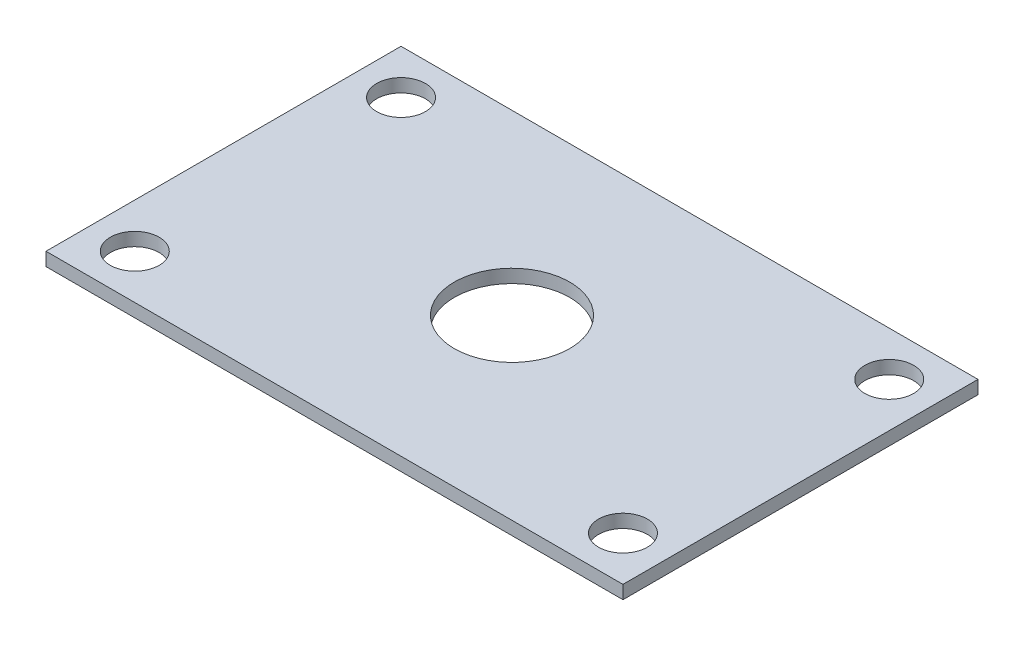
from build123d import *

# Parameters (mm, degrees)
CROQUIS1_W              = 130
CROQUIS1_H              = 80
SALIENTE_EXTRUIR1_DEPTH = 3
CROQUIS2_R              = 13
CORTAR_EXTRUIR1_DEPTH   = 3
CROQUIS3_R              = 5.5
CORTAR_EXTRUIR2_DEPTH   = 3


with BuildPart() as part:
    # Croquis1 → Saliente-Extruir1 (new body)
    with BuildSketch(Plane(origin=(0, 0, 0), x_dir=(1, 0, 0), z_dir=(0, 1, 0))):
        Rectangle(CROQUIS1_W, CROQUIS1_H)
    extrude(amount=SALIENTE_EXTRUIR1_DEPTH)

    # Croquis2 → Cortar-Extruir1 (cut)
    with BuildSketch(Plane(origin=(0, 3, 0), x_dir=(1, 0, 0), z_dir=(0, 1, 0))):
        with Locations(Location((0, 0, 0), (0, 0, 270))):
            Circle(CROQUIS2_R)
    extrude(amount=-CORTAR_EXTRUIR1_DEPTH, mode=Mode.SUBTRACT)

    # Croquis3 → Cortar-Extruir2 (cut)
    with BuildSketch(Plane(origin=(0, 3, 0), x_dir=(1, 0, 0), z_dir=(0, 1, 0))):
        with Locations(Location((-55, 30, 0), (0, 0, 270))):
            Circle(CROQUIS3_R)
        with Locations(Location((-55, -30, 0), (0, 0, 270))):
            Circle(CROQUIS3_R)
        with Locations(Location((55, 30, 0), (0, 0, 270))):
            Circle(CROQUIS3_R)
        with Locations(Location((55, -30, 0), (0, 0, 270))):
            Circle(CROQUIS3_R)
    extrude(amount=-CORTAR_EXTRUIR2_DEPTH, mode=Mode.SUBTRACT)


solid = part.part
